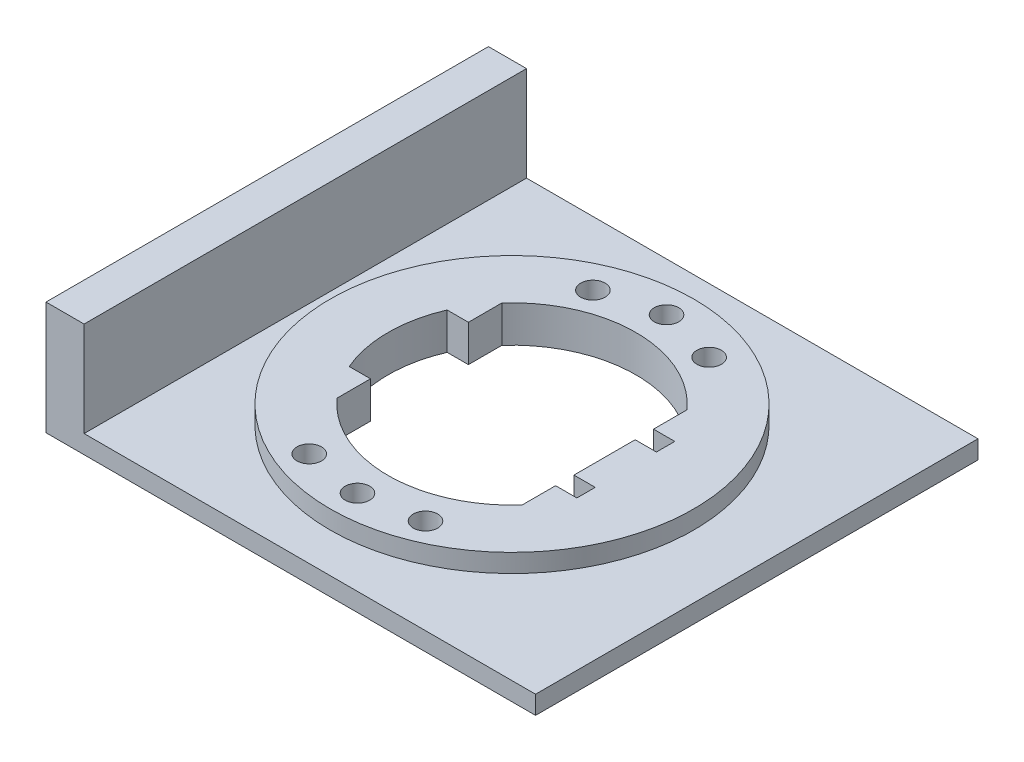
from build123d import *

# Parameters (mm, degrees)
SKETCH1_W           = 80
SKETCH1_H           = 72.3
BOSS_EXTRUDE1_DEPTH = 6
SKETCH2_W           = 80
SKETCH2_H           = 72.3
SKETCH2_R           = 29.705
CUT_EXTRUDE1_DEPTH  = 3
CUT_EXTRUDE3_DEPTH  = 85.912071325
SKETCH5_R           = 2
CUT_EXTRUDE4_DEPTH  = 85.912071325
SKETCH6_R           = 2
CUT_EXTRUDE5_DEPTH  = 85.912071325
SKETCH8_W           = 6.225749038
SKETCH8_H           = 72.3
BOSS_EXTRUDE2_DEPTH = 15.5


with BuildPart() as part:
    # Sketch1 → Boss-Extrude1 (new body)
    with BuildSketch(Plane(origin=(0, 0, 0), x_dir=(1, 0, 0), z_dir=(0, 1, 0))):
        with Locations((1.546657586, 37.660128709)):
            Rectangle(SKETCH1_W, SKETCH1_H)
    extrude(amount=BOSS_EXTRUDE1_DEPTH)

    # Sketch2 → Cut-Extrude1 (cut)
    with BuildSketch(Plane(origin=(0, 6, 0), x_dir=(-1, 0, 0), z_dir=(0, 1, 0))):
        with Locations((-1.546657586, -37.660128709)):
            Rectangle(SKETCH2_W, SKETCH2_H)
        with Locations(Location((-1.546657586, -37.660128709, 0), (0, 0, 90))):
            Circle(SKETCH2_R, mode=Mode.SUBTRACT)
    extrude(amount=-CUT_EXTRUDE1_DEPTH, mode=Mode.SUBTRACT)

    # Sketch3 → Cut-Extrude3 (cut, through all)
    with BuildSketch(Plane(origin=(0, 6, 0), x_dir=(-1, 0, 0), z_dir=(0, 1, 0))):
        with BuildLine():
            ThreePointArc((-16.671348492, -51.125128709), (-1.546657586, -57.910128709), (13.57803332, -51.125128709))
            Line((13.57803332, -51.125128709), (13.57803332, -45.660128709))
            Line((13.57803332, -45.660128709), (17.056097586, -45.660128709))
            ThreePointArc((17.056097586, -45.660128709), (18.703342414, -37.660128709), (17.056097586, -29.660128709))
            Line((17.056097586, -29.660128709), (13.57803332, -29.660128709))
            Line((13.57803332, -29.660128709), (13.57803332, -24.195128709))
            ThreePointArc((13.57803332, -24.195128709), (-1.546657586, -17.410128709), (-16.671348492, -24.195128709))
            Line((-16.671348492, -24.195128709), (-16.671348492, -29.660128709))
            Line((-16.671348492, -29.660128709), (-20.149412759, -29.660128709))
            Line((-20.149412759, -29.660128709), (-20.149412759, -32.660128709))
            Line((-20.149412759, -32.660128709), (-16.671348492, -32.660128709))
            Line((-16.671348492, -32.660128709), (-16.671348492, -42.660128709))
            Line((-16.671348492, -42.660128709), (-20.149412759, -42.660128709))
            Line((-20.149412759, -42.660128709), (-20.149412759, -45.660128709))
            Line((-20.149412759, -45.660128709), (-16.671348492, -45.660128709))
            Line((-16.671348492, -45.660128709), (-16.671348492, -51.125128709))
        make_face()
    extrude(amount=-CUT_EXTRUDE3_DEPTH, mode=Mode.SUBTRACT)

    # Sketch5 → Cut-Extrude4 (cut, through all)
    with BuildSketch(Plane(origin=(0, 6, 0), x_dir=(-1, 0, 0), z_dir=(0, 1, 0))):
        with Locations(Location((-1.546657586, -12.410128709, 0), (0, 0, 90))):
            Circle(SKETCH5_R)
        with Locations(Location((-1.546657586, -62.910128709, 0), (0, 0, 90))):
            Circle(SKETCH5_R)
    extrude(amount=-CUT_EXTRUDE4_DEPTH, mode=Mode.SUBTRACT)

    # Sketch6 → Cut-Extrude5 (cut, through all)
    with BuildSketch(Plane(origin=(0, 6, 0), x_dir=(1, 0, 0), z_dir=(0, 1, 0))):
        with Locations(Location((-7.953342414, 60.376565813, 0), (0, 0, 270))):
            Circle(SKETCH6_R)
        with Locations(Location((11.046657586, 60.376565813, 0), (0, 0, 270))):
            Circle(SKETCH6_R)
        with Locations(Location((11.046657586, 14.026565813, 0), (0, 0, 270))):
            Circle(SKETCH6_R)
        with Locations(Location((-7.953342414, 14.026565813, 0), (0, 0, 270))):
            Circle(SKETCH6_R)
    extrude(amount=-CUT_EXTRUDE5_DEPTH, mode=Mode.SUBTRACT)

    # Sketch8 → Boss-Extrude2 (add)
    with BuildSketch(Plane(origin=(0, 3, 0), x_dir=(1, 0, 0), z_dir=(0, 1, 0))):
        with Locations((-35.340467895, 37.660128709)):
            Rectangle(SKETCH8_W, SKETCH8_H)
    extrude(amount=BOSS_EXTRUDE2_DEPTH)


solid = part.part
